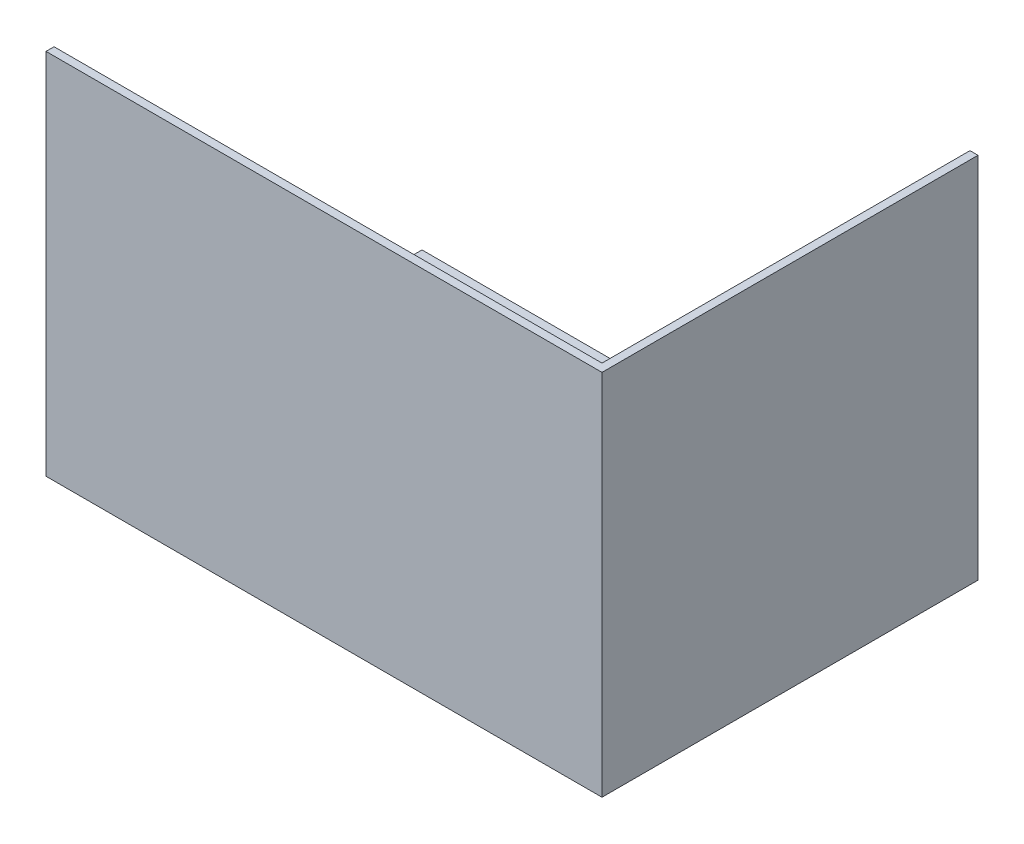
from build123d import *

# Parameters (mm, degrees)
SKETCH1_W           = 235.4072
SKETCH1_H           = 159.2072
BOSS_EXTRUDE1_DEPTH = 3.4036
SKETCH2_W           = 3.4036
SKETCH2_H           = 155.8036
BOSS_EXTRUDE2_DEPTH = 152.4


with BuildPart() as part:
    # Sketch1 → Boss-Extrude1 (new body)
    with BuildSketch(Plane(origin=(0, 0, 0), x_dir=(1, 0, 0), z_dir=(0, 1, 0))):
        with Locations((117.7036, 79.6036)):
            Rectangle(SKETCH1_W, SKETCH1_H)
    extrude(amount=BOSS_EXTRUDE1_DEPTH)

    # Sketch2 → Boss-Extrude2 (add)
    with BuildSketch(Plane(origin=(0, 3.4036, 0), x_dir=(1, 0, 0), z_dir=(0, 1, 0))):
        Polygon((232.0036, 3.4036), (0, 3.4036), (0, 0), (235.4072, 0), (235.4072, 3.4036), align=None)
        with Locations((233.7054, 81.3054)):
            Rectangle(SKETCH2_W, SKETCH2_H)
    extrude(amount=BOSS_EXTRUDE2_DEPTH)


solid = part.part
